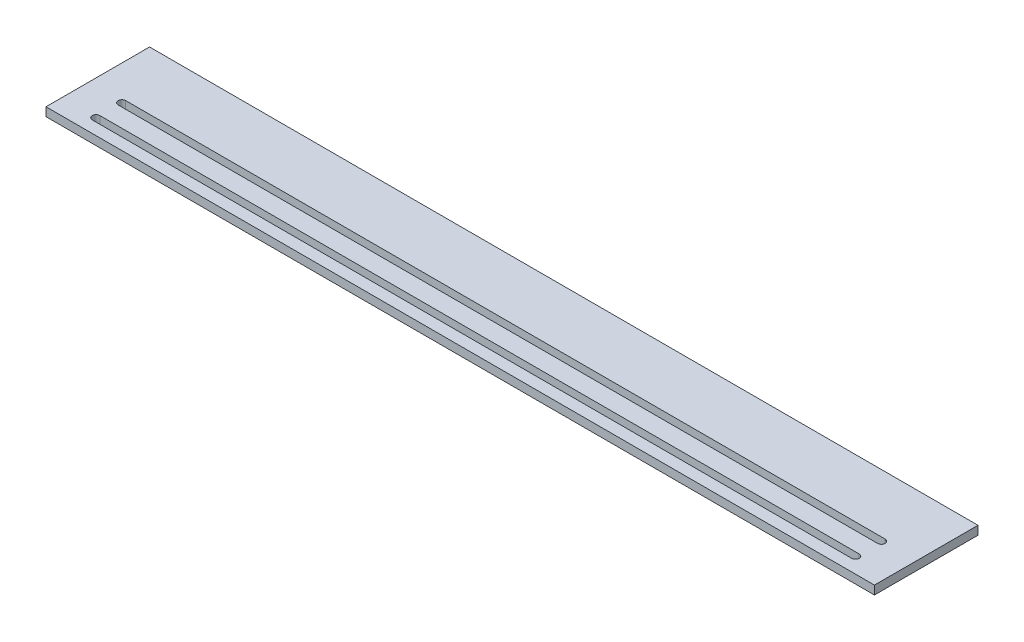
from build123d import *

# Parameters (mm, degrees)
SKETCH1_W           = 609.6
SKETCH1_H           = 76.2
BOSS_EXTRUDE1_DEPTH = 3.175
CUT_EXTRUDE1_DEPTH  = 308.237648246


with BuildPart() as part:
    # Sketch1 → Boss-Extrude1 (new, symmetric)
    with BuildSketch(Plane(origin=(0, 0, 0), x_dir=(1, 0, 0), z_dir=(0, 1, 0))):
        Rectangle(SKETCH1_W, SKETCH1_H)
    extrude(amount=BOSS_EXTRUDE1_DEPTH, both=True)

    # Sketch2 → Cut-Extrude1 (cut, through all)
    with BuildSketch(Plane(origin=(0, 3.175, 0), x_dir=(1, 0, 0), z_dir=(0, 1, 0))):
        with BuildLine():
            Line((-279.4, -4.841875), (279.4, -4.841875))
            ThreePointArc((279.4, -4.841875), (282.178125, -7.62), (279.4, -10.398125))
            Line((279.4, -10.398125), (-279.4, -10.398125))
            ThreePointArc((-279.4, -10.398125), (-282.178125, -7.62), (-279.4, -4.841875))
        make_face()
        with BuildLine():
            Line((-279.4, -23.891875), (279.4, -23.891875))
            ThreePointArc((279.4, -23.891875), (282.178125, -26.67), (279.4, -29.448125))
            Line((279.4, -29.448125), (-279.4, -29.448125))
            ThreePointArc((-279.4, -29.448125), (-282.178125, -26.67), (-279.4, -23.891875))
        make_face()
    extrude(amount=-CUT_EXTRUDE1_DEPTH, mode=Mode.SUBTRACT)


solid = part.part
